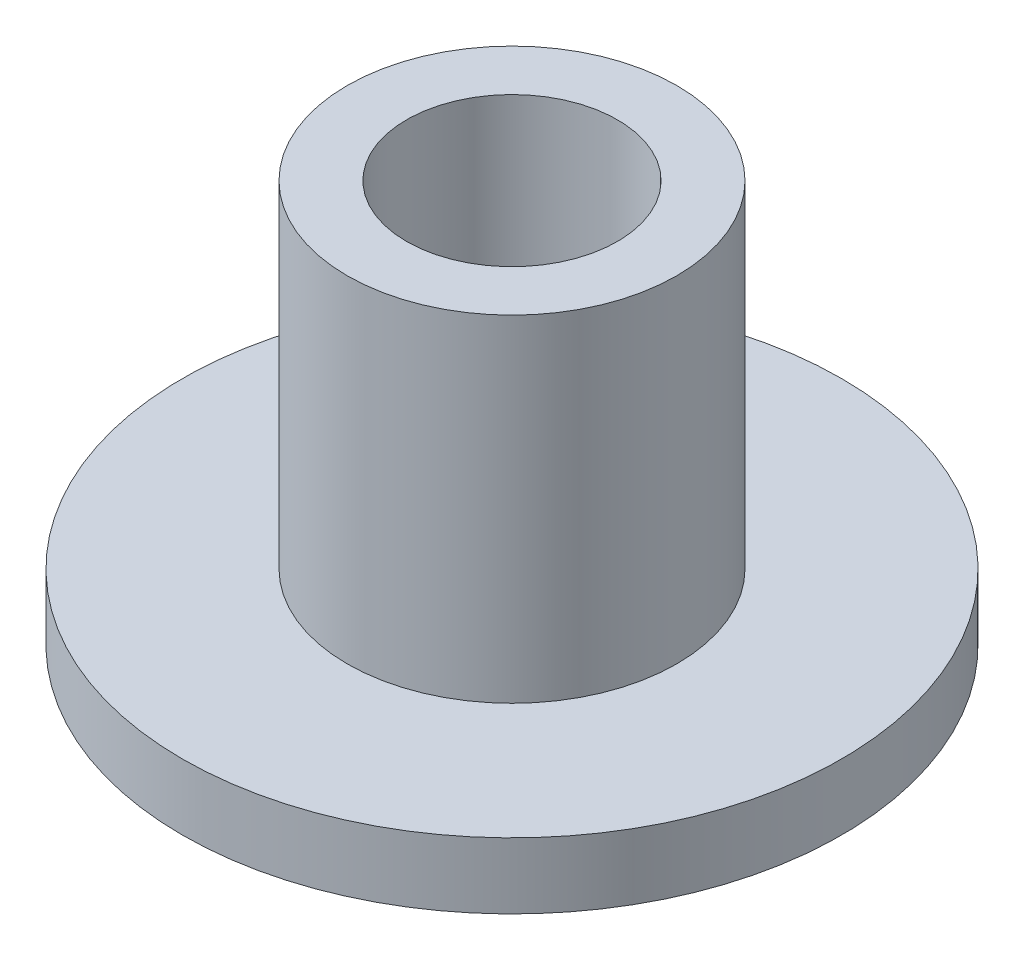
from build123d import *

# Parameters (mm, degrees)
SKETCH1_R            = 5
BOSS_EXTRUDE1_DEPTH  = 6.1
M3_CLEARANCE_HOLE1_D = 3.2
SKETCH4_R            = 5.808101239
SKETCH4_R_2          = 2.5
CUT_EXTRUDE1_DEPTH   = 5.1


with BuildPart() as part:
    # Sketch1 → Boss-Extrude1 (new body)
    with BuildSketch(Plane(origin=(0, 0, 0), x_dir=(1, 0, 0), z_dir=(0, 1, 0))):
        with Locations(Location((0, 0, 0), (0, 0, 270))):
            Circle(SKETCH1_R)
    extrude(amount=BOSS_EXTRUDE1_DEPTH)

    # M3 Clearance Hole1 (through all)
    with Locations(Plane(origin=(0, 6.1, 0), x_dir=(-1, 0, 0), z_dir=(0, 1, 0))):
        with Locations((0, 0)):
            Hole(M3_CLEARANCE_HOLE1_D / 2)

    # Sketch4 → Cut-Extrude1 (cut)
    with BuildSketch(Plane(origin=(0, 6.1, 0), x_dir=(1, 0, 0), z_dir=(0, 1, 0))):
        Circle(SKETCH4_R)
        with Locations(Location((0, 0, 0), (0, 0, 270))):
            Circle(SKETCH4_R_2, mode=Mode.SUBTRACT)
    extrude(amount=-CUT_EXTRUDE1_DEPTH, mode=Mode.SUBTRACT)


solid = part.part
